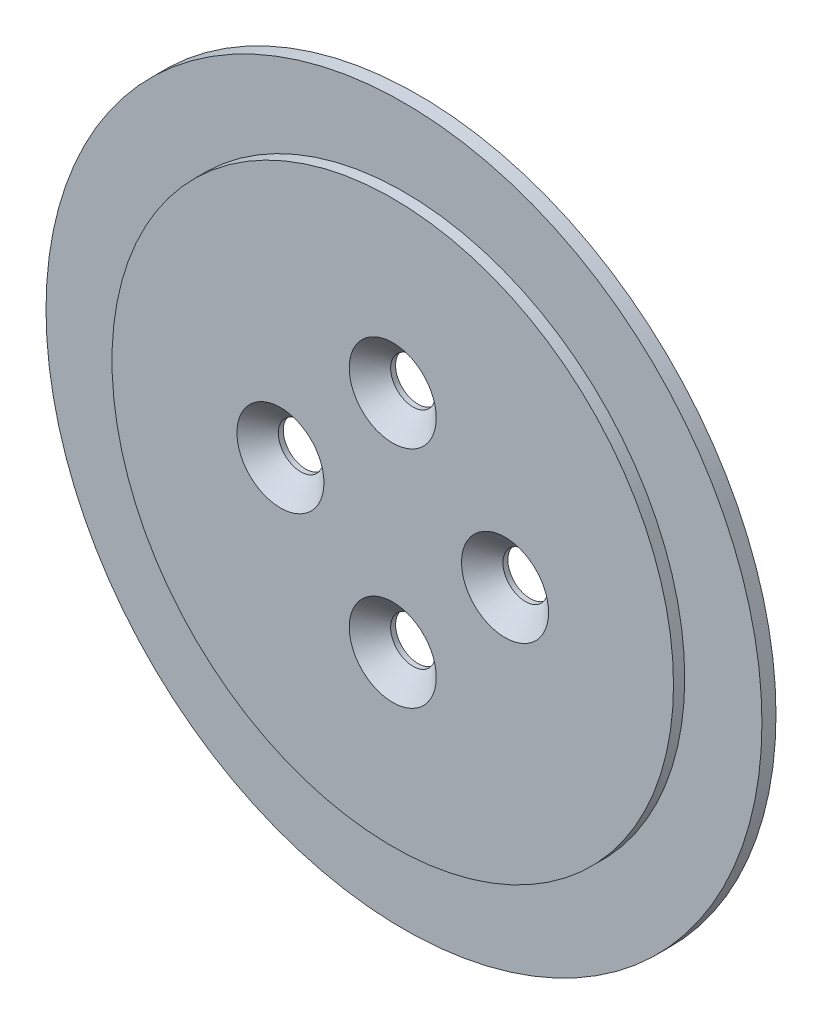
from build123d import *

# Parameters (mm, degrees)
SKETCH1_R           = 25.5
SKETCH1_R_2         = 20
BOSS_EXTRUDE1_DEPTH = 1
SKETCH1_3_R         = 20
BOSS_EXTRUDE2_DEPTH = 1.8
HOLE1_AT_2_COUNT    = 2
HOLE1_AT_2_PITCH    = 11.313708499
HOLE1_AT_3_COUNT    = 2
HOLE1_AT_3_PITCH    = 16
HOLE1_AT_4_COUNT    = 2
HOLE1_AT_4_PITCH    = 11.313708499


with BuildPart() as part:
    # Sketch1 → Boss-Extrude1 (new body)
    with BuildSketch(Plane.XY):
        Circle(SKETCH1_R)
        Circle(SKETCH1_R_2, mode=Mode.SUBTRACT)
    extrude(amount=BOSS_EXTRUDE1_DEPTH)

    # Sketch1<3> → Boss-Extrude2 (add)
    with BuildSketch(Plane.XY):
        Circle(SKETCH1_3_R)
    extrude(amount=BOSS_EXTRUDE2_DEPTH)

    # Sketch4 → Hole1 (revolve, cut)
    with BuildSketch(Plane(origin=(-8, 0, 1.8), x_dir=(0, -1, 0), z_dir=(1, 0, 0))):
        Polygon((0, 0), (0, 1.8), (1.6, 1.8), (1.6, 1.448533162), (3.1, 0), align=None)
    hole1 = revolve(axis=Axis((-8, 0, 8.245314094), (0, 0, -1)), mode=Mode.SUBTRACT)

    # Hole1 at 2: Hole1 ×2
    with Locations(*[Vector(0.7071067811865276, 0.7071067811865676, 0) * (i * HOLE1_AT_2_PITCH) for i in range(1, HOLE1_AT_2_COUNT)]):
        add(hole1, mode=Mode.SUBTRACT)

    # Hole1 at 3: Hole1 ×2
    with Locations(*[(i * HOLE1_AT_3_PITCH, 0, 0) for i in range(1, HOLE1_AT_3_COUNT)]):
        add(hole1, mode=Mode.SUBTRACT)

    # Hole1 at 4: Hole1 ×2
    with Locations(*[Vector(0.7071067811865676, -0.7071067811865276, 0) * (i * HOLE1_AT_4_PITCH) for i in range(1, HOLE1_AT_4_COUNT)]):
        add(hole1, mode=Mode.SUBTRACT)


solid = part.part
